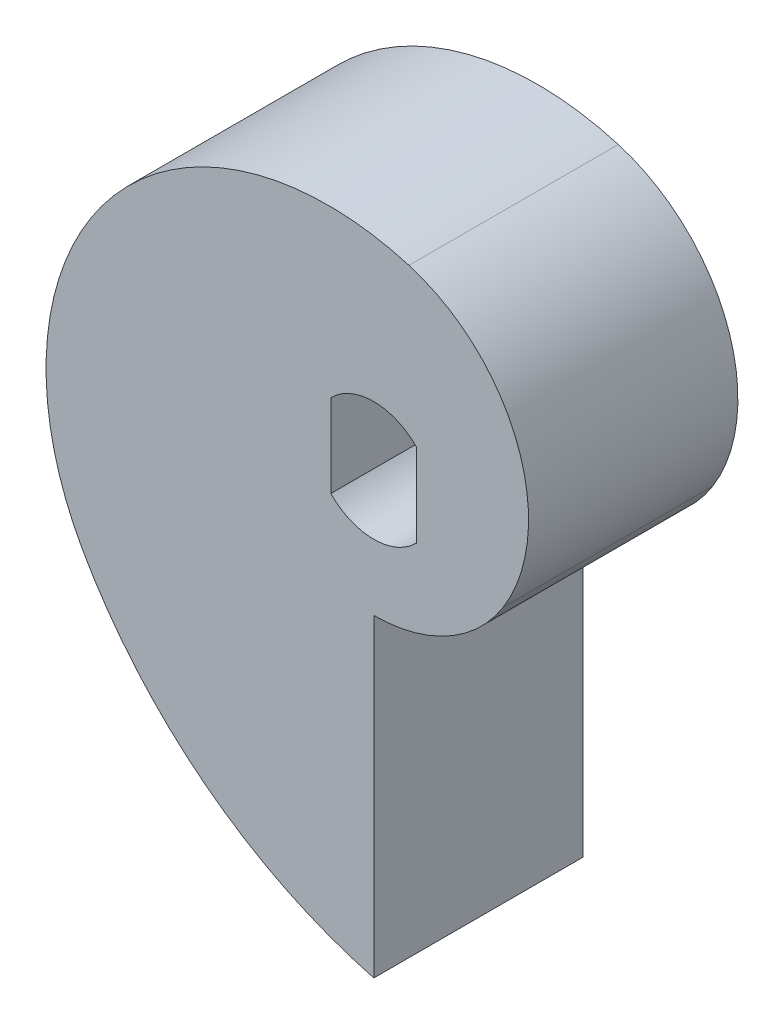
from build123d import *

# Parameters (mm, degrees)
EXTRUDE_448_DEPTH = 10


with BuildPart() as part:
    # Эскиз1 → Extrude 448 (new body)
    with BuildSketch(Plane.XY):
        with BuildLine():
            Line((0, -6), (0, -21))
            ThreePointArc((0, -21), (-8.058831333, -17.01600504), (-13.929161871, -10.207466455))
            ThreePointArc((-13.929161871, -10.207466455), (-12.703453351, 4.817077167), (1.681331293, 9.324542439))
            ThreePointArc((1.681331293, 9.324542439), (6.878554189, 4.4907399), (6.181719822, -2.572630025))
            ThreePointArc((6.181719822, -2.572630025), (3.534137975, -5.085826245), (0, -6))
        make_face()
        with BuildLine():
            Line((-2.05, 1.979898987), (-2.05, -1.979898987))
            ThreePointArc((-2.05, -1.979898987), (0, -2.85), (2.05, -1.979898987))
            Line((2.05, -1.979898987), (2.05, 1.979898987))
            ThreePointArc((2.05, 1.979898987), (0, 2.85), (-2.05, 1.979898987))
        make_face(mode=Mode.SUBTRACT)
    extrude(amount=EXTRUDE_448_DEPTH)


solid = part.part
